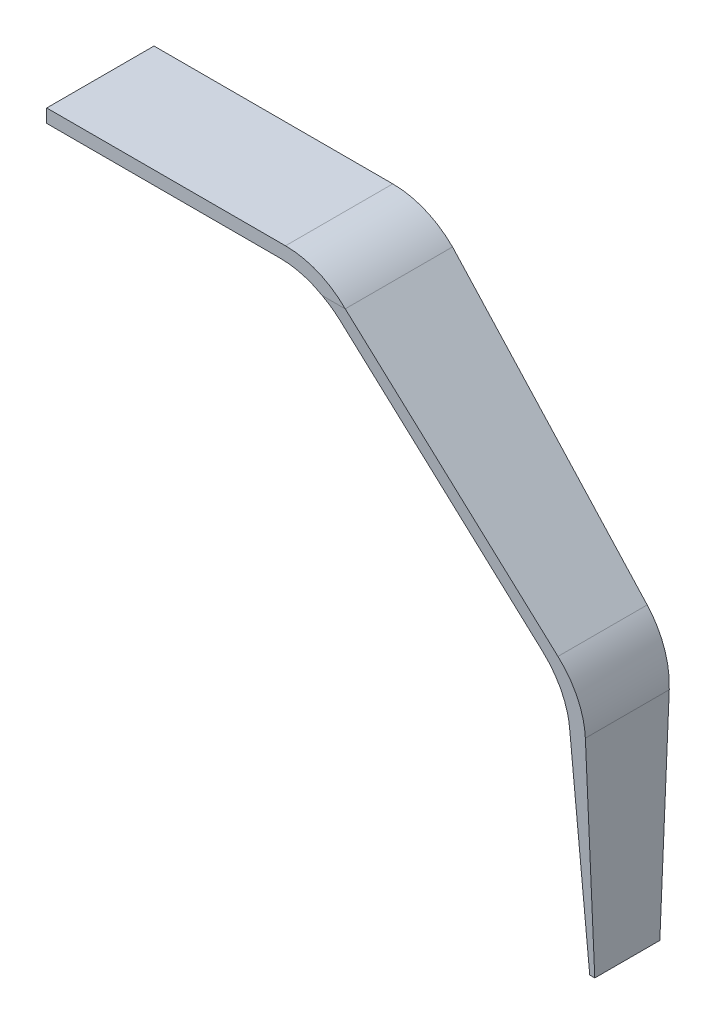
from build123d import *

# Parameters (mm, degrees)
BOSS_EXTRUDE1_DEPTH = 25.4
CUT_EXTRUDE1_DEPTH  = 165.4


with BuildPart() as part:
    # Sketch1 → Boss-Extrude1 (new body)
    with BuildSketch(Plane.XY):
        with BuildLine():
            ThreePointArc((5.857864376, 51.292135624), (-0.6306026, 55.62759065), (-8.284271247, 57.15))
            Line((-8.284271247, 57.15), (-63.5, 57.15))
            Line((-63.5, 57.15), (-63.5, 60.325))
            Line((-63.5, 60.325), (-6.969143187, 60.325))
            ThreePointArc((-6.969143187, 60.325), (0.68452546, 58.80259065), (7.172992437, 54.467135624))
            Line((7.172992437, 54.467135624), (6.735192091, 54.90493597))
            Line((6.735192091, 54.90493597), (54.90493597, 6.735192091))
            Line((54.90493597, 6.735192091), (55.397071593, 6.243056467))
            ThreePointArc((55.397071593, 6.243056467), (59.73252662, -0.245410509), (61.25493597, -7.899079157))
            Line((61.25493597, -7.899079157), (61.25493597, -58.192189171))
            Line((61.25493597, -58.192189171), (60.059609459, -58.192189171))
            Line((60.059609459, -58.192189171), (57.534761691, -7.695233822))
            ThreePointArc((57.534761691, -7.695233822), (55.840378599, -0.581197787), (51.701850537, 5.448149463))
            Line((51.701850537, 5.448149463), (5.857864376, 51.292135624))
        make_face()
    extrude(amount=BOSS_EXTRUDE1_DEPTH)

    # Sketch2 → Cut-Extrude1 (cut)
    with BuildSketch(Plane(origin=(61.25493597, 0, 0), x_dir=(0, 0, -1), z_dir=(1, 0, 0))):
        Polygon((-25.4, 54.467135624), (-20.4, -58.192189171), (-53.926173028, -59.680134048), align=None)
        Polygon((0, 54.467135624), (-5, -58.192189171), (16.325141492, -58.192189171), align=None)
    extrude(amount=-CUT_EXTRUDE1_DEPTH, mode=Mode.SUBTRACT)


solid = part.part
